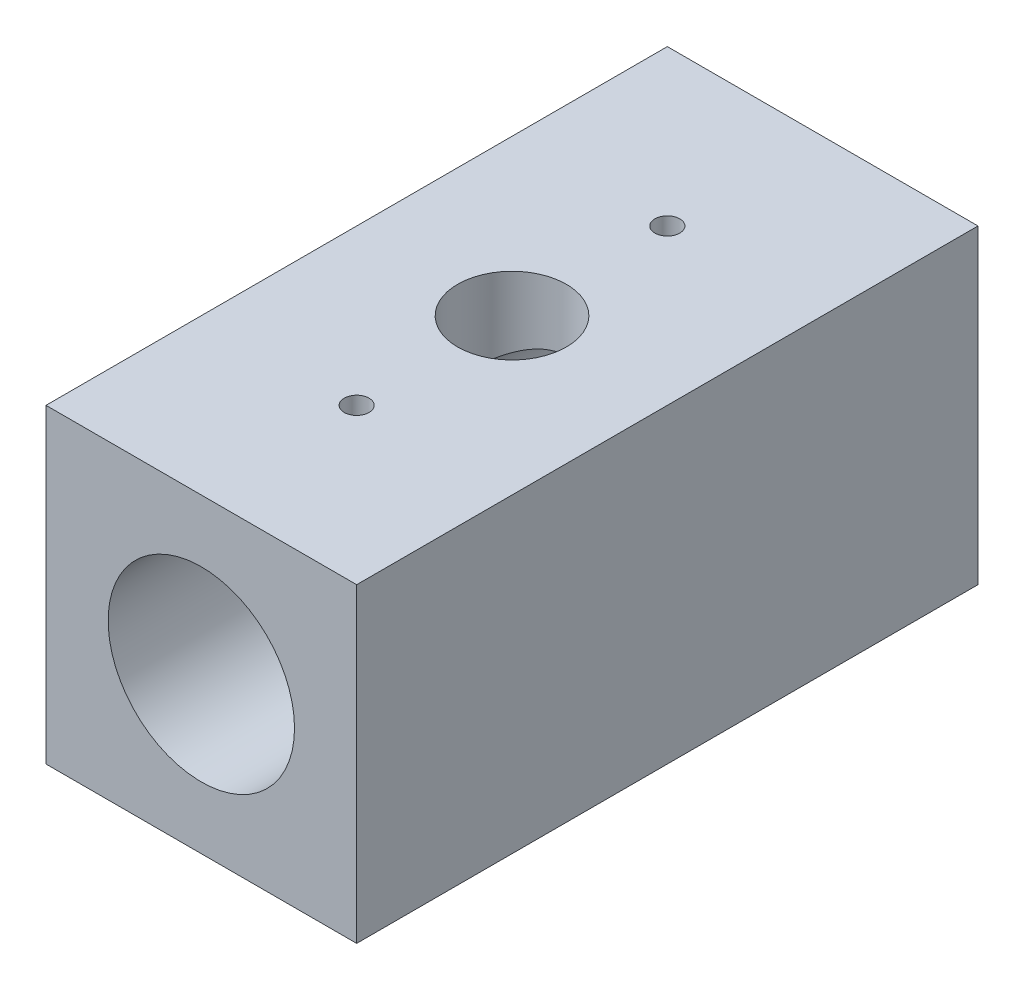
from build123d import *

# Parameters (mm, degrees)
SKIZZE1_W                            = 20
SKIZZE1_H                            = 20
SKIZZE1_R                            = 6
AUFSATZ_LINEAR_AUSTRAGEN1_DEPTH      = 40
SKIZZE2_R                            = 1
SKIZZE2_R_2                          = 1.75
SCHNITT_LINEAR_AUSTRAGEN1_DEPTH      = 3
SKIZZE3_R                            = 0.5
SCHNITT_LINEAR_AUSTRAGEN2_DEPTH      = 2
SCHNITT_LINEAR_AUSTRAGEN3_REACH      = 46.989
SCHNITT_LINEAR_AUSTRAGEN3_END_RADIUS = 6
SKIZZE4_R                            = 3.25
F_7_0_7_DURCHMESSER_BOHRUNG1_REACH   = 32
F_7_0_7_DURCHMESSER_BOHRUNG1_BORE_R  = 3.5
M2_GEWINDEBOHRUNG1_REACH             = 39.417
M2_GEWINDEBOHRUNG1_BORE_R            = 0.8


with BuildPart() as part:
    # Skizze1 → Aufsatz-Linear austragen1 (new body)
    with BuildSketch(Plane.XY):
        Rectangle(SKIZZE1_W, SKIZZE1_H)
        Circle(SKIZZE1_R, mode=Mode.SUBTRACT)
    extrude(amount=AUFSATZ_LINEAR_AUSTRAGEN1_DEPTH)

    # Skizze2 → Schnitt-Linear austragen1 (cut)
    with BuildSketch(Plane.XZ.offset(10)):
        with Locations(Location((0, 30, 0), (0, 0, 270))):
            Circle(SKIZZE2_R)
        with Locations(Location((0, 10, 0), (0, 0, 270))):
            Circle(SKIZZE2_R)
        with Locations(Location((0, 20, 0), (0, 0, 270))):
            Circle(SKIZZE2_R_2)
    extrude(amount=-SCHNITT_LINEAR_AUSTRAGEN1_DEPTH, mode=Mode.SUBTRACT)

    # Skizze3 → Schnitt-Linear austragen2 (cut)
    with BuildSketch(Plane.XZ.offset(7)):
        with Locations(Location((0, 30, 0), (0, 0, 270))):
            Circle(SKIZZE3_R)
        with Locations(Location((0, 10, 0), (0, 0, 270))):
            Circle(SKIZZE3_R)
    extrude(amount=-SCHNITT_LINEAR_AUSTRAGEN2_DEPTH, mode=Mode.SUBTRACT)

    # Schnitt-Linear austragen3: up to this cylinder (the profile starts outside it)
    schnitt_linear_austragen3_end = Plane(origin=(0, 0, 20), z_dir=(0, 0, -1)) * Cylinder(SCHNITT_LINEAR_AUSTRAGEN3_END_RADIUS, 106.978, mode=Mode.PRIVATE)
    # Skizze4 → Schnitt-Linear austragen3 (cut, up to the surface)
    with BuildSketch(Plane(origin=(0, -8, 0), x_dir=(-1, 0, 0), z_dir=(0, -1, 0)), mode=Mode.PRIVATE) as schnitt_linear_austragen3_sk1:
        with Locations(Location((0, -20, 0), (0, 0, 90))):
            Circle(SKIZZE4_R)
    schnitt_linear_austragen3_tool1 = extrude(schnitt_linear_austragen3_sk1.sketch, amount=-SCHNITT_LINEAR_AUSTRAGEN3_REACH, mode=Mode.PRIVATE) - schnitt_linear_austragen3_end
    add(schnitt_linear_austragen3_tool1.solids().sort_by_distance((0, -8, 20))[0], mode=Mode.SUBTRACT)

    # Ø7.0 (7) Durchmesser Bohrung1 bore (on position points) → Ø7.0 (7) Durchmesser Bohrung1 (cut, up to next)
    with BuildSketch(Plane(origin=(0, 10, 20), x_dir=(0, 0, 1), z_dir=(0, 1, 0)), mode=Mode.PRIVATE) as f_7_0_7_durchmesser_bohrung1_sk1:
        Circle(F_7_0_7_DURCHMESSER_BOHRUNG1_BORE_R)
    f_7_0_7_durchmesser_bohrung1_tool1 = extrude(f_7_0_7_durchmesser_bohrung1_sk1.sketch, amount=-F_7_0_7_DURCHMESSER_BOHRUNG1_REACH, mode=Mode.PRIVATE) & part.part
    add(f_7_0_7_durchmesser_bohrung1_tool1.solids().sort_by_distance((0, 10, 20))[0], mode=Mode.SUBTRACT)

    # M2 Gewindebohrung1 bore (on position points) → M2 Gewindebohrung1 (cut, up to next)
    with BuildSketch(Plane(origin=(0, 10, 30), x_dir=(0, 0, 1), z_dir=(0, 1, 0)), mode=Mode.PRIVATE) as m2_gewindebohrung1_sk1:
        Circle(M2_GEWINDEBOHRUNG1_BORE_R)
    m2_gewindebohrung1_tool1 = extrude(m2_gewindebohrung1_sk1.sketch, amount=-M2_GEWINDEBOHRUNG1_REACH, mode=Mode.PRIVATE) & part.part
    # M2 Gewindebohrung1 bore (on position points) → M2 Gewindebohrung1 (cut, up to next)
    with BuildSketch(Plane(origin=(0, 10, 30), x_dir=(0, 0, 1), z_dir=(0, 1, 0)), mode=Mode.PRIVATE) as m2_gewindebohrung1_sk2:
        with Locations((-20, 0)):
            Circle(M2_GEWINDEBOHRUNG1_BORE_R)
    m2_gewindebohrung1_tool2 = extrude(m2_gewindebohrung1_sk2.sketch, amount=-M2_GEWINDEBOHRUNG1_REACH, mode=Mode.PRIVATE) & part.part
    add(m2_gewindebohrung1_tool1.solids().sort_by_distance((0, 10, 30))[0], mode=Mode.SUBTRACT)
    add(m2_gewindebohrung1_tool2.solids().sort_by_distance((0, 10, 10))[0], mode=Mode.SUBTRACT)


solid = part.part
